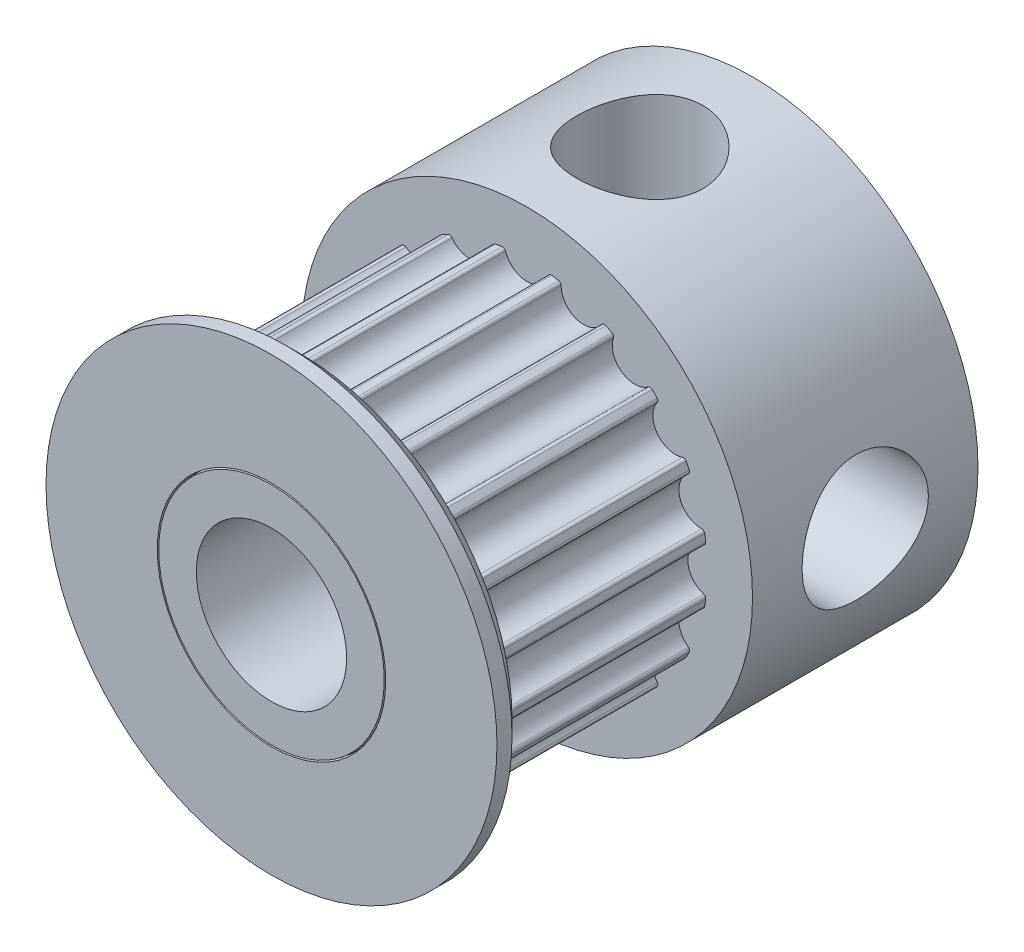
from build123d import *

# Parameters (mm, degrees)
SKETCH1_R              = 7.5
BOSS_EXTRUDE1_DEPTH    = 7.5
SKETCH2_R              = 6
BOSS_EXTRUDE2_DEPTH    = 7.5
SKETCH3_R              = 0.75
CUT_EXTRUDE1_DEPTH     = 7.5
FILLET1_R              = 0.1
SKETCH4_R              = 7.5
BOSS_EXTRUDE3_DEPTH    = 1
CHAMFER1_SIZE          = 0.5
CUT_EXTRUDE2_REACH     = 21.196
SKETCH5_R              = 2.5
M5_TAPPED_HOLE1_REACH  = 25.179
M5_TAPPED_HOLE1_BORE_R = 2.1
CIRPATTERN3_COUNT      = 2
CIRPATTERN3_ANGLE      = 90


with BuildPart() as part:
    # Sketch1 → Boss-Extrude1 (new body)
    with BuildSketch(Plane.XY):
        Circle(SKETCH1_R)
    extrude(amount=BOSS_EXTRUDE1_DEPTH)

    # Sketch2 → Boss-Extrude2 (add)
    with BuildSketch(Plane.XY.offset(7.5)):
        Circle(SKETCH2_R)
    extrude(amount=BOSS_EXTRUDE2_DEPTH)

    # Sketch3 → Cut-Extrude1 (cut)
    with BuildSketch(Plane.XY.offset(15)):
        with Locations((0, 6.1)):
            Circle(SKETCH3_R)
        with Locations((1.885003666, 5.801444749)):
            Circle(SKETCH3_R)
        with Locations((3.585490039, 4.935003666)):
            Circle(SKETCH3_R)
        with Locations((4.935003666, 3.585490039)):
            Circle(SKETCH3_R)
        with Locations((5.801444749, 1.885003666)):
            Circle(SKETCH3_R)
        with Locations((6.1, 0)):
            Circle(SKETCH3_R)
        with Locations((5.801444749, -1.885003666)):
            Circle(SKETCH3_R)
        with Locations((4.935003666, -3.585490039)):
            Circle(SKETCH3_R)
        with Locations((3.585490039, -4.935003666)):
            Circle(SKETCH3_R)
        with Locations((1.885003666, -5.801444749)):
            Circle(SKETCH3_R)
        with Locations((0, -6.1)):
            Circle(SKETCH3_R)
        with Locations((-1.885003666, -5.801444749)):
            Circle(SKETCH3_R)
        with Locations((-3.585490039, -4.935003666)):
            Circle(SKETCH3_R)
        with Locations((-4.935003666, -3.585490039)):
            Circle(SKETCH3_R)
        with Locations((-5.801444749, -1.885003666)):
            Circle(SKETCH3_R)
        with Locations((-6.1, 0)):
            Circle(SKETCH3_R)
        with Locations((-5.801444749, 1.885003666)):
            Circle(SKETCH3_R)
        with Locations((-4.935003666, 3.585490039)):
            Circle(SKETCH3_R)
        with Locations((-3.585490039, 4.935003666)):
            Circle(SKETCH3_R)
        with Locations((-1.885003666, 5.801444749)):
            Circle(SKETCH3_R)
    extrude(amount=-CUT_EXTRUDE1_DEPTH, mode=Mode.SUBTRACT)

    # Fillet1
    fillet1_edges = [part.edges().sort_by_distance(p)[0] for p in [
        (4.38497568, -4.095361802, 11.25),
        (5.249952533, -2.904823299, 11.25),
        (2.904823299, -5.249952533, 11.25),
        (4.095361802, -4.38497568, 11.25),
        (5.435896089, -2.539888523, 11.25),
        (5.890641332, -1.140326575, 11.25),
        (5.954713115, -0.73579326, 11.25),
        (5.954713115, 0.73579326, 11.25),
        (2.539888523, 5.435896089, 11.25),
        (1.140326575, 5.890641332, 11.25),
        (4.095361802, 4.38497568, 11.25),
        (2.904823299, 5.249952533, 11.25),
        (5.249952533, 2.904823299, 11.25),
        (4.38497568, 4.095361802, 11.25),
        (5.890641332, 1.140326575, 11.25),
        (5.435896089, 2.539888523, 11.25),
        (-2.904823299, 5.249952533, 11.25),
        (-4.095361802, 4.38497568, 11.25),
        (-4.38497568, 4.095361802, 11.25),
        (-5.249952533, 2.904823299, 11.25),
        (-1.140326575, 5.890641332, 11.25),
        (-2.539888523, 5.435896089, 11.25),
        (0.73579326, 5.954713115, 11.25),
        (-0.73579326, 5.954713115, 11.25),
        (1.140326575, -5.890641332, 11.25),
        (2.539888523, -5.435896089, 11.25),
        (-0.73579326, -5.954713115, 11.25),
        (0.73579326, -5.954713115, 11.25),
        (-2.539888523, -5.435896089, 11.25),
        (-1.140326575, -5.890641332, 11.25),
        (-4.095361802, -4.38497568, 11.25),
        (-2.904823299, -5.249952533, 11.25),
        (-5.249952533, -2.904823299, 11.25),
        (-4.38497568, -4.095361802, 11.25),
        (-5.890641332, -1.140326575, 11.25),
        (-5.435896089, -2.539888523, 11.25),
        (-5.954713115, 0.73579326, 11.25),
        (-5.954713115, -0.73579326, 11.25),
        (-5.435896089, 2.539888523, 11.25),
        (-5.890641332, 1.140326575, 11.25),
    ]]
    fillet(fillet1_edges, radius=FILLET1_R)

    # Sketch4 → Boss-Extrude3 (add)
    with BuildSketch(Plane.XY.offset(15)):
        Circle(SKETCH4_R)
    extrude(amount=BOSS_EXTRUDE3_DEPTH)

    # Chamfer1
    chamfer1_edges = [part.edges().sort_by_distance(p)[0] for p in [
        (-7.5, 0, 15),
    ]]
    chamfer(chamfer1_edges, length=CHAMFER1_SIZE)

    # Sketch5 → Cut-Extrude2 (cut, up to next)
    with BuildSketch(Plane.XY.offset(16), mode=Mode.PRIVATE) as cut_extrude2_sk1:
        Circle(SKETCH5_R)
    cut_extrude2_tool1 = extrude(cut_extrude2_sk1.sketch, amount=-CUT_EXTRUDE2_REACH, mode=Mode.PRIVATE) & part.part
    add(cut_extrude2_tool1.solids().sort_by_distance((0, 0, 16))[0], mode=Mode.SUBTRACT)

    # M5 Tapped Hole1 bore → M5 Tapped Hole1 (cut, up to next)
    with BuildSketch(Plane(origin=(0, 7.5, 0), x_dir=(1, 0, 0), z_dir=(0, 1, 0)), mode=Mode.PRIVATE) as m5_tapped_hole1_sk1:
        with Locations((0, -3.75)):
            Circle(M5_TAPPED_HOLE1_BORE_R)
    m5_tapped_hole1_tool1 = extrude(m5_tapped_hole1_sk1.sketch, amount=-M5_TAPPED_HOLE1_REACH, mode=Mode.PRIVATE) & part.part
    m5_tapped_hole1 = m5_tapped_hole1_tool1.solids().sort_by_distance((0, 7.5, 3.75))[0]
    add(m5_tapped_hole1, mode=Mode.SUBTRACT)

    # CirPattern3: M5 Tapped Hole1 ×2 about axis
    cirpattern3_axis = Axis((0, 0, 7.5), (0, 0, -1))
    for i in range(1, CIRPATTERN3_COUNT):
        add(m5_tapped_hole1.rotate(cirpattern3_axis, i * CIRPATTERN3_ANGLE / (CIRPATTERN3_COUNT - 1)), mode=Mode.SUBTRACT)

    # Sketch8 → Cut-Revolve1 (revolve, cut)
    with BuildSketch(Plane(origin=(0, 0, 0), x_dir=(1, 0, 0), z_dir=(0, 1, 0)), mode=Mode.PRIVATE) as cut_revolve1_sk:
        Polygon((-3.75, 0), (-3.775, -0.15), (-3.8, 0), align=None)
    cut_revolve1 = revolve(cut_revolve1_sk.sketch.rotate(Axis((0, 0, 7.5), (0, 0, -1)), 180), axis=Axis((0, 0, 7.5), (0, 0, -1)), mode=Mode.SUBTRACT)

    # Mirror1: Cut-Revolve1 across plane
    add(cut_revolve1.mirror(Plane(origin=(0, 0, 8), x_dir=(1, 0, 0), z_dir=(0, 0, -1))), mode=Mode.SUBTRACT)


solid = part.part
